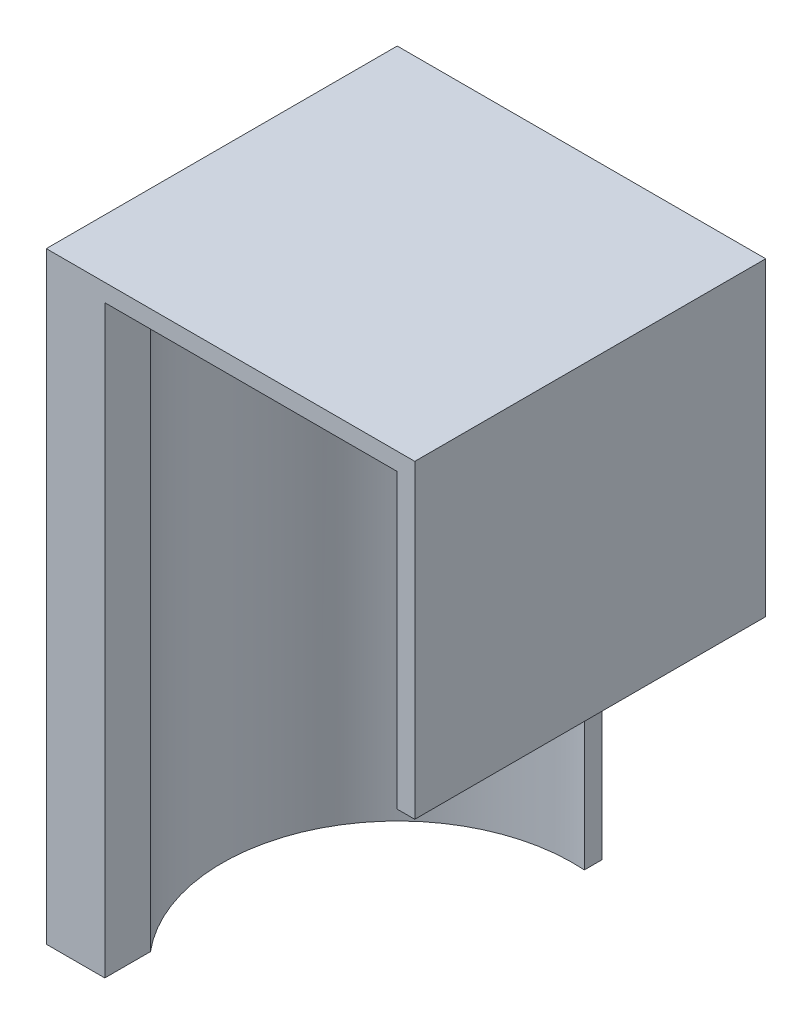
from build123d import *

# Parameters (mm, degrees)
SKETCH1_W           = 60
SKETCH1_H           = 100
BOSS_EXTRUDE1_DEPTH = 3
SKETCH2_W           = 3
SKETCH2_H           = 50
BOSS_EXTRUDE2_DEPTH = 60
SKETCH3_W           = 3
SKETCH3_H           = 50
BOSS_EXTRUDE3_DEPTH = 57
SKETCH4_W           = 63
SKETCH4_H           = 60
BOSS_EXTRUDE4_DEPTH = 3
BOSS_EXTRUDE6_REACH = 123.939


with BuildPart() as part:
    # Sketch1 → Boss-Extrude1 (new body)
    with BuildSketch(Plane(origin=(0, 0, 0), x_dir=(0, 0, -1), z_dir=(1, 0, 0))):
        Rectangle(SKETCH1_W, SKETCH1_H)
    extrude(amount=BOSS_EXTRUDE1_DEPTH)

    # Sketch2 → Boss-Extrude2 (add)
    with BuildSketch(Plane(origin=(3, 0, 0), x_dir=(0, 0, -1), z_dir=(1, 0, 0))):
        with Locations((28.5, 25)):
            Rectangle(SKETCH2_W, SKETCH2_H)
    extrude(amount=BOSS_EXTRUDE2_DEPTH)

    # Sketch3 → Boss-Extrude3 (add)
    with BuildSketch(Plane.XY.offset(-27)):
        with Locations((61.5, 25)):
            Rectangle(SKETCH3_W, SKETCH3_H)
    extrude(amount=BOSS_EXTRUDE3_DEPTH)

    # Sketch4 → Boss-Extrude4 (add)
    with BuildSketch(Plane(origin=(0, 50, 0), x_dir=(1, 0, 0), z_dir=(0, 1, 0))):
        with Locations((31.5, 0)):
            Rectangle(SKETCH4_W, SKETCH4_H)
    extrude(amount=BOSS_EXTRUDE4_DEPTH)

    # Boss-Extrude6: up to this face of the body (flat: up to its plane)
    boss_extrude6_end = Plane(part.part.faces().sort_by_distance((1.5, -50, 0))[0])
    # Sketch7 → Boss-Extrude6 (add, up to the picked face)
    with BuildSketch(Plane.XZ.offset(-50), mode=Mode.PRIVATE) as boss_extrude6_sk1:
        with BuildLine():
            Line((0, -30), (35, -30))
            Line((35, -30), (35, -27))
            ThreePointArc((35, -27), (6.255324942, -10.658001188), (10, 22.194619378))
            Line((10, 22.194619378), (10, 30))
            Line((10, 30), (0, 30))
            Line((0, 30), (0, -30))
        make_face()
    boss_extrude6_tool1 = split(extrude(boss_extrude6_sk1.sketch, amount=BOSS_EXTRUDE6_REACH, mode=Mode.PRIVATE), bisect_by=boss_extrude6_end, keep=Keep.BOTH, mode=Mode.PRIVATE)
    add(boss_extrude6_tool1.solids().sort_by(Axis((17.5, 50, -29.305378), (0, -1, 0)))[0])


solid = part.part
